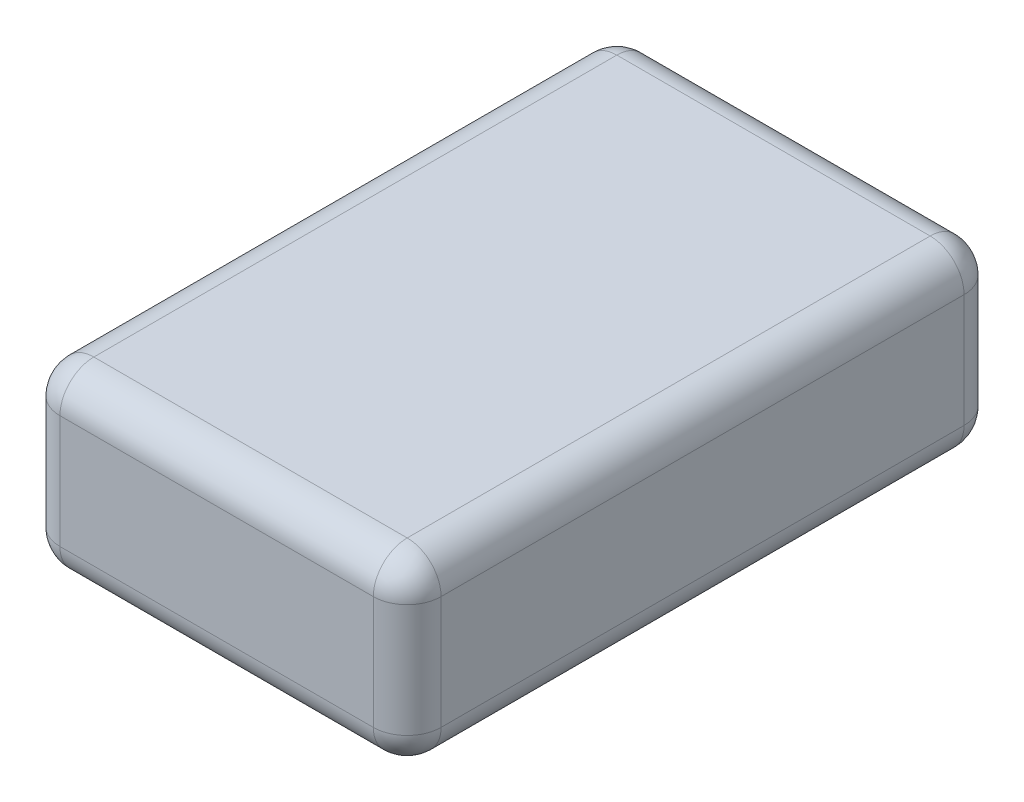
from build123d import *

# Parameters (mm, degrees)
SKETCH1_W           = 20
SKETCH1_H           = 30.999999976
BOSS_EXTRUDE1_DEPTH = 4.75
FILLET1_R           = 1.778


with BuildPart() as part:
    # Sketch1 → Boss-Extrude1 (new, symmetric)
    with BuildSketch(Plane(origin=(0, 0, 0), x_dir=(1, 0, 0), z_dir=(0, 1, 0))):
        Rectangle(SKETCH1_W, SKETCH1_H)
    extrude(amount=BOSS_EXTRUDE1_DEPTH, both=True)

    # Fillet1
    fillet1_edges = [part.edges().sort_by_distance(p)[0] for p in [
        (-10, 4.75, 0),
        (0, 4.75, 15.499999988),
        (10, 4.75, 0),
        (0, -4.75, 15.499999988),
        (-10, -4.75, 0),
        (0, -4.75, -15.499999988),
        (10, -4.75, 0),
        (0, 4.75, -15.499999988),
        (10, 0, 15.499999988),
        (-10, 0, 15.499999988),
        (-10, 0, -15.499999988),
        (10, 0, -15.499999988),
    ]]
    fillet(fillet1_edges, radius=FILLET1_R)


solid = part.part
